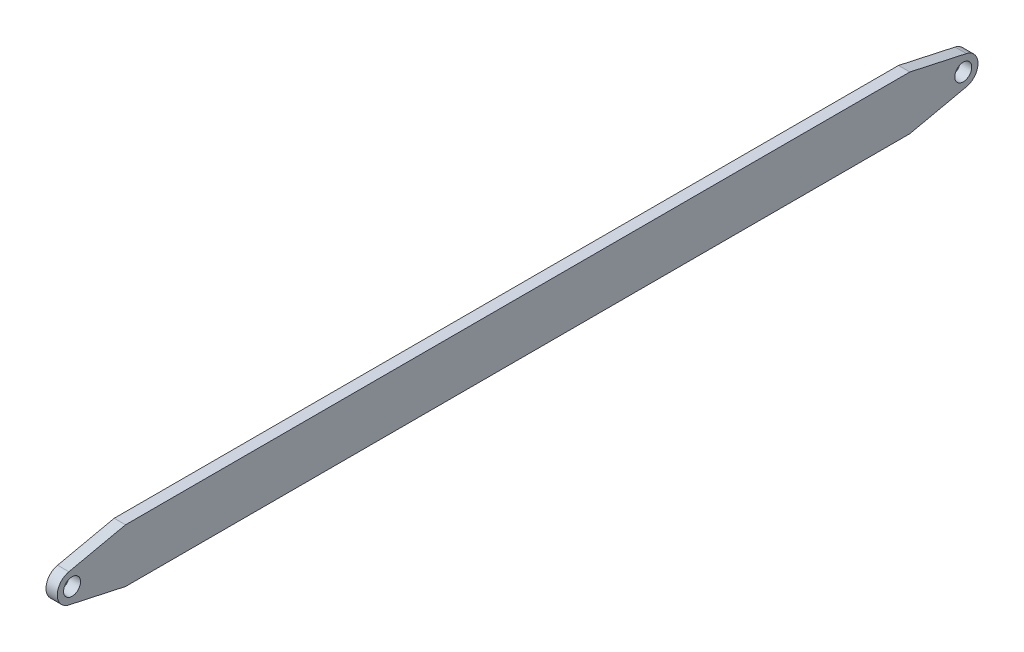
from build123d import *

# Parameters (mm, degrees)
SKETCH1_R           = 4.7625
BOSS_EXTRUDE1_DEPTH = 3.175


with BuildPart() as part:
    # Sketch1 → Boss-Extrude1 (new, symmetric)
    with BuildSketch(Plane(origin=(0, 0, 0), x_dir=(0, 0, -1), z_dir=(1, 0, 0))):
        with BuildLine():
            Line((30, 15), (-1.760727799, 8.072716015))
            ThreePointArc((-1.760727799, 8.072716015), (-8.2625, 0), (-1.760727799, -8.072716015))
            Line((-1.760727799, -8.072716015), (30, -15))
            Line((30, -15), (470, -15))
            Line((470, -15), (501.760727799, -8.072716015))
            ThreePointArc((501.760727799, -8.072716015), (508.2625, 0), (501.760727799, 8.072716015))
            Line((501.760727799, 8.072716015), (470, 15))
            Line((470, 15), (30, 15))
        make_face()
        Circle(SKETCH1_R, mode=Mode.SUBTRACT)
        with Locations(Location((500, 0, 0), (0, 0, 180))):
            Circle(SKETCH1_R, mode=Mode.SUBTRACT)
    extrude(amount=BOSS_EXTRUDE1_DEPTH, both=True)


solid = part.part
